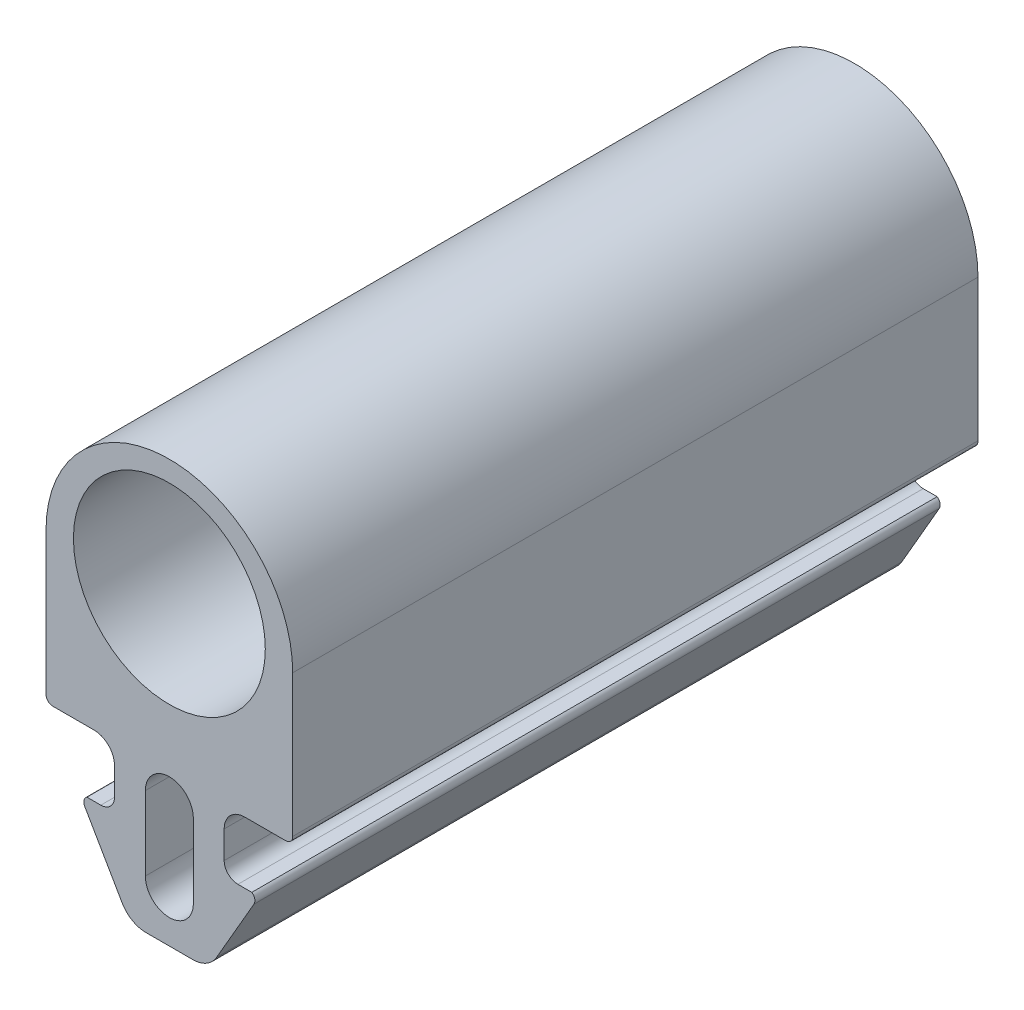
from build123d import *

# Parameters (mm, degrees)
ESQUISSE1_R        = 7
BOSS_EXTRU_1_DEPTH = 50


with BuildPart() as part:
    # Esquisse1 → Boss.-Extru.1 (new body)
    with BuildSketch(Plane.XY.offset(20)):
        with BuildLine():
            Line((-9, 10.864586864), (-9, 0.523924837))
            ThreePointArc((-9, 0.523924837), (-8.854824532, 0.14661401), (-8.478070356, 0))
            Line((-8.478070356, 0), (-5.5, 0))
            ThreePointArc((-5.5, 0), (-4.439339828, -0.439339828), (-4, -1.5))
            Line((-4, -1.5), (-4, -3.5))
            ThreePointArc((-4, -3.5), (-4.292893219, -4.207106781), (-5, -4.5))
            Line((-5, -4.5), (-6.016007613, -4.5))
            ThreePointArc((-6.016007613, -4.5), (-6.227713349, -4.802430523), (-6.174193657, -5.16769643))
            Line((-6.174193657, -5.16769643), (-3.440043573, -9.90338329))
            ThreePointArc((-3.440043573, -9.90338329), (-2.707992766, -10.635434098), (-1.707992766, -10.90338329))
            Line((-1.707992766, -10.90338329), (1.707992766, -10.90338329))
            ThreePointArc((1.707992766, -10.90338329), (2.707992766, -10.635434098), (3.440043573, -9.90338329))
            Line((3.440043573, -9.90338329), (6.174193657, -5.16769643))
            ThreePointArc((6.174193657, -5.16769643), (6.227713349, -4.802430523), (6.016007614, -4.5))
            Line((6.016007614, -4.5), (5, -4.5))
            ThreePointArc((5, -4.5), (4.292893219, -4.207106781), (4, -3.5))
            Line((4, -3.5), (4, -1.5))
            ThreePointArc((4, -1.5), (4.439339828, -0.439339828), (5.5, 0))
            Line((5.5, 0), (8.478070356, 0))
            ThreePointArc((8.478070356, 0), (8.854824532, 0.14661401), (9, 0.523924837))
            Line((9, 0.523924837), (9, 10.864586864))
            ThreePointArc((9, 10.864586864), (0, 19.864586864), (-9, 10.864586864))
        make_face()
        with Locations((0, 11.36)):
            Circle(ESQUISSE1_R, mode=Mode.SUBTRACT)
        with BuildLine():
            Line((1.75, -1.95338329), (1.75, -7.351528839))
            ThreePointArc((1.75, -7.351528839), (0, -9.101528839), (-1.75, -7.351528839))
            Line((-1.75, -7.351528839), (-1.75, -1.95338329))
            ThreePointArc((-1.75, -1.95338329), (0, -0.20338329), (1.75, -1.95338329))
        make_face(mode=Mode.SUBTRACT)
    extrude(amount=-BOSS_EXTRU_1_DEPTH)


solid = part.part
